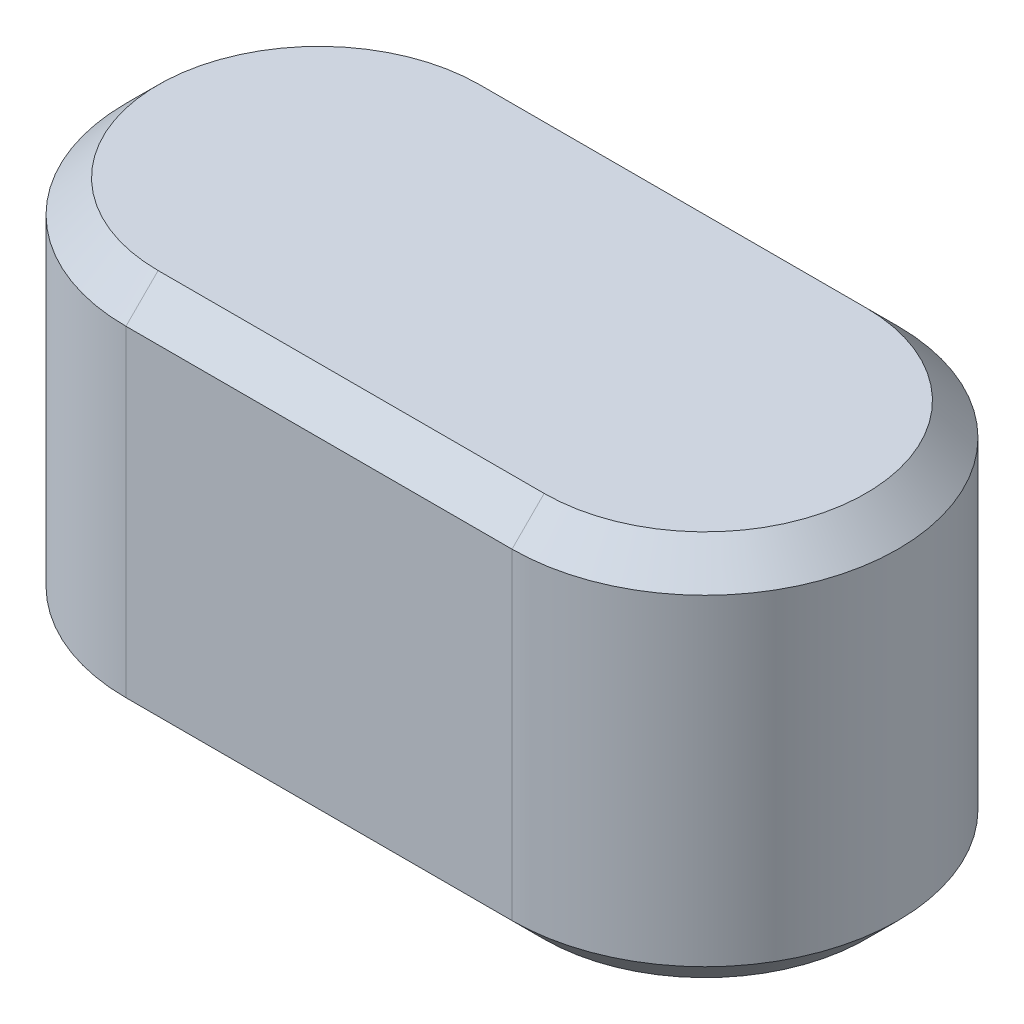
from build123d import *

# Parameters (mm, degrees)
EXTRUDE_1_DEPTH = 6
CHAMFER_1_SIZE  = 0.5


with BuildPart() as part:
    # 草图1 → 凸台-拉伸1 (new body)
    with BuildSketch(Plane(origin=(0, 0, 0), x_dir=(1, 0, 0), z_dir=(0, 1, 0))):
        with BuildLine():
            Line((0, 3), (6, 3))
            ThreePointArc((6, 3), (9, 0), (6, -3))
            Line((6, -3), (0, -3))
            ThreePointArc((0, -3), (-3, 0), (0, 3))
        make_face()
    extrude(amount=EXTRUDE_1_DEPTH)

    # 倒角1
    chamfer_1_edges = [part.edges().sort_by_distance(p)[0] for p in [
        (9, 6, 0),
        (3, 6, -3),
        (-3, 6, 0),
        (3, 0, -3),
        (9, 0, 0),
        (3, 0, 3),
        (-3, 0, 0),
        (3, 6, 3),
    ]]
    chamfer(chamfer_1_edges, length=CHAMFER_1_SIZE)


solid = part.part
